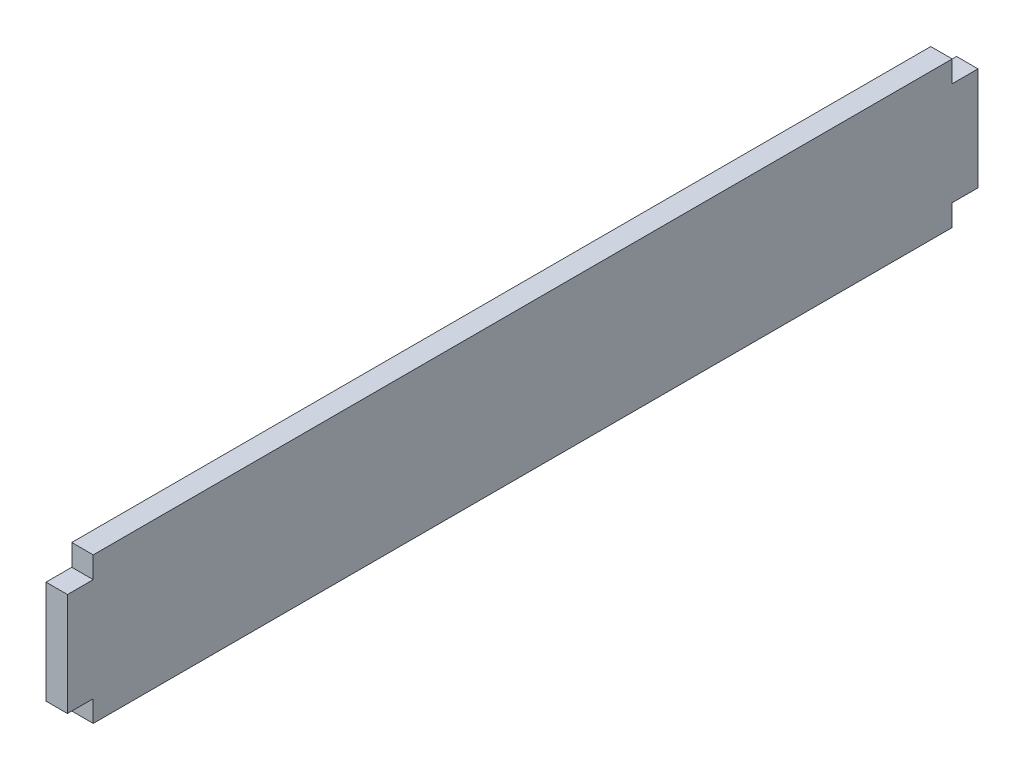
from build123d import *

# Parameters (mm, degrees)
SKETCH1_W           = 2.5
SKETCH1_H           = 17
BOSS_EXTRUDE1_DEPTH = 100
SKETCH1_3_W         = 2.5
SKETCH1_3_H         = 12
BOSS_EXTRUDE2_DEPTH = 3


with BuildPart() as part:
    # Sketch1 → Boss-Extrude1 (new body)
    with BuildSketch(Plane.XY):
        Rectangle(SKETCH1_W, SKETCH1_H)
    extrude(amount=BOSS_EXTRUDE1_DEPTH)

    # Sketch1<3> → Boss-Extrude2 (add)
    with BuildSketch(Plane.XY):
        Rectangle(SKETCH1_3_W, SKETCH1_3_H)
    boss_extrude2 = extrude(amount=-BOSS_EXTRUDE2_DEPTH)

    # Mirror1: Boss-Extrude2 across plane
    add(boss_extrude2.mirror(Plane(origin=(0, 0, 50), x_dir=(1, 0, 0), z_dir=(0, 0, -1))))


solid = part.part
